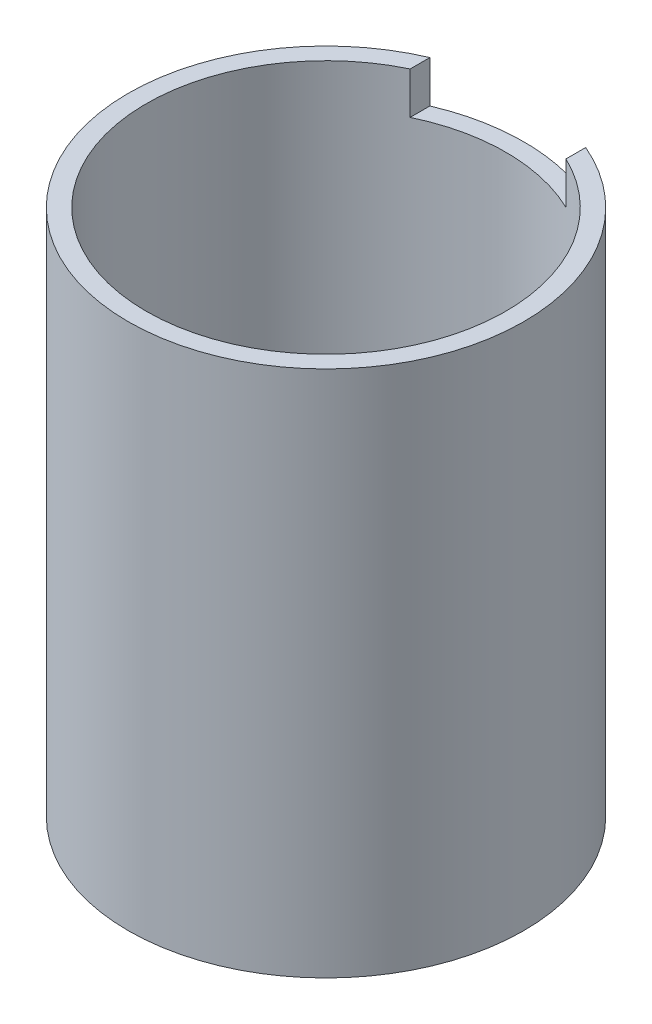
from build123d import *

# Parameters (mm, degrees)
SKETCH1_R           = 16.5
SKETCH1_R_2         = 15
BOSS_EXTRUDE1_DEPTH = 44
SKETCH3_W           = 13
SKETCH3_H           = 3.5
CUT_EXTRUDE1_DEPTH  = 44


with BuildPart() as part:
    # Sketch1 → Boss-Extrude1 (new body)
    with BuildSketch(Plane(origin=(0, 0, 0), x_dir=(1, 0, 0), z_dir=(0, 1, 0))):
        with Locations(Location((0, 0, 0), (0, 0, 270))):
            Circle(SKETCH1_R)
        with Locations(Location((0, 0, 0), (0, 0, 270))):
            Circle(SKETCH1_R_2, mode=Mode.SUBTRACT)
    extrude(amount=BOSS_EXTRUDE1_DEPTH)

    # Sketch3 → Cut-Extrude1 (cut)
    with BuildSketch(Plane.XY):
        with Locations((0, 1.75)):
            Rectangle(SKETCH3_W, SKETCH3_H)
        with Locations((0, 42.25)):
            Rectangle(SKETCH3_W, SKETCH3_H)
    extrude(amount=-CUT_EXTRUDE1_DEPTH, mode=Mode.SUBTRACT)


solid = part.part
